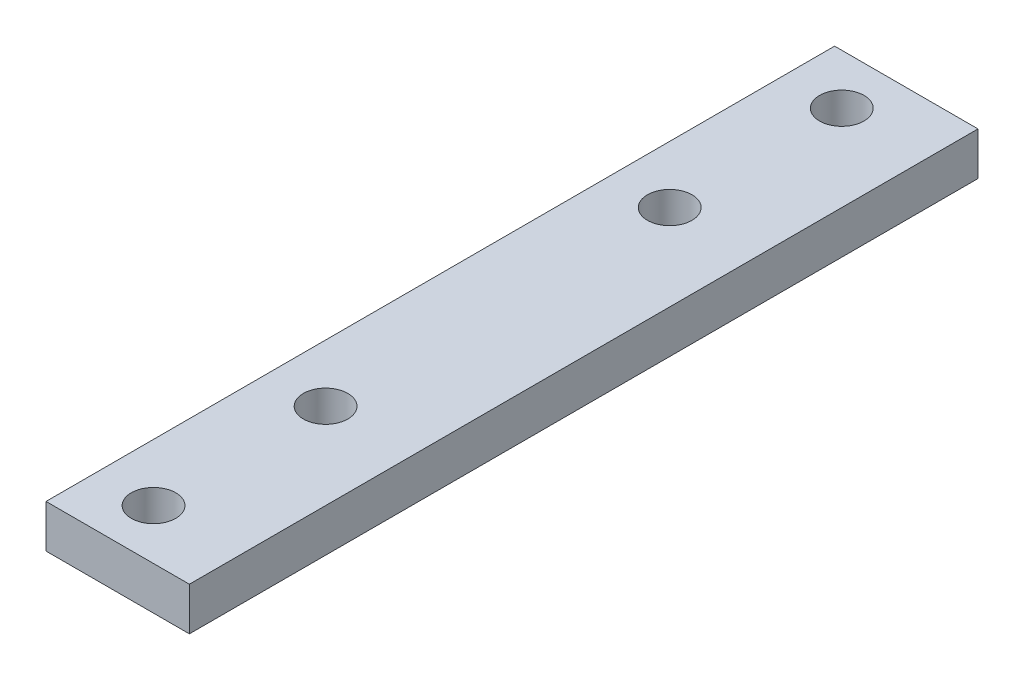
from build123d import *

# Parameters (mm, degrees)
BOSS_EXTRUDE1_DEPTH = 45
SKETCH2_W           = 31
SKETCH2_H           = 37
BOSS_EXTRUDE3_START = -45
BOSS_EXTRUDE3_DEPTH = 45
SKETCH4_R           = 5.05
CUT_EXTRUDE1_DEPTH  = 12
SKETCH5_W           = 5
SKETCH5_H           = 35
CUT_EXTRUDE2_DEPTH  = 67.895440801
BOSS_EXTRUDE5_DEPTH = 37
BOSS_EXTRUDE6_START = 5
SKETCH7_W           = 17.5
SKETCH7_H           = 7.441015215
BOSS_EXTRUDE6_DEPTH = 5
SKETCH9_W           = 15
SKETCH9_H           = 55
SKETCH9_W_2         = 10
BOSS_EXTRUDE7_DEPTH = 3
SKETCH12_R          = 1.55
CUT_EXTRUDE5_DEPTH  = 5
SKETCH13_W          = 7
SKETCH13_H          = 4
CUT_EXTRUDE6_DEPTH  = 90.162772501
CUT_EXTRUDE7_DEPTH  = 74.993242935


with BuildPart() as part:
    # Sketch1 → Boss-Extrude1 (new body)
    with BuildSketch(Plane.XY):
        with BuildLine():
            Line((35, 0), (-35, 0))
            ThreePointArc((-35, 0), (0, -35), (35, 0))
        make_face()
    extrude(amount=BOSS_EXTRUDE1_DEPTH)

    # Sketch2 → Cut-Revolve1 (revolve, cut)
    with BuildSketch(Plane(origin=(0, 0, 0), x_dir=(1, 0, 0), z_dir=(0, 1, 0))):
        with Locations((-15.5, -22.5)):
            Rectangle(SKETCH2_W, SKETCH2_H)
    revolve(axis=Axis((0, 0, 0), (0, 0, 1)), mode=Mode.SUBTRACT)

    # Sketch3 → Boss-Extrude3 (add)
    with BuildSketch(Plane.XY.offset(45).offset(BOSS_EXTRUDE3_START)):
        with BuildLine():
            Line((-17.5, -30.310889132), (-17.5, 0))
            Line((-17.5, 0), (-35, 0))
            Line((-35, 0), (-35, -35))
            Line((-35, -35), (0, -35))
            ThreePointArc((0, -35), (-9.058666579, -33.80740392), (-17.5, -30.310889132))
        make_face()
    extrude(amount=BOSS_EXTRUDE3_DEPTH)

    # Sketch4 → Cut-Extrude1 (cut)
    with BuildSketch(Plane.ZY.offset(35)):
        with Locations((10, -17.5)):
            Circle(SKETCH4_R)
        with Locations((35, -17.5)):
            Circle(SKETCH4_R)
    extrude(amount=-CUT_EXTRUDE1_DEPTH, mode=Mode.SUBTRACT)

    # Sketch5 → Cut-Extrude2 (cut, through all)
    with BuildSketch(Plane(origin=(0, 0, 0), x_dir=(-1, 0, 0), z_dir=(0, 0, -1))):
        with Locations((32.5, -17.5)):
            Rectangle(SKETCH5_W, SKETCH5_H)
    extrude(amount=-CUT_EXTRUDE2_DEPTH, mode=Mode.SUBTRACT)

    # Sketch6 → Boss-Extrude5 (add)
    with BuildSketch(Plane(origin=(0, 0, 41), x_dir=(-1, 0, 0), z_dir=(0, 0, -1))):
        with BuildLine():
            ThreePointArc((-31, 0), (-25.966324345, -16.933694222), (-12.5, -28.368115905))
            Line((-12.5, -28.368115905), (-12.5, 0))
            Line((-12.5, 0), (-31, 0))
        make_face()
        with BuildLine():
            Line((12.5, 0), (12.5, -28.368115905))
            ThreePointArc((12.5, -28.368115905), (15.064267175, -27.093686617), (17.5, -25.588083164))
            Line((17.5, -25.588083164), (17.5, 0))
            Line((17.5, 0), (12.5, 0))
        make_face()
    extrude(amount=BOSS_EXTRUDE5_DEPTH)

    # Sketch7 → Boss-Extrude6 (add)
    with BuildSketch(Plane(origin=(0, 0, 0), x_dir=(-1, 0, 0), z_dir=(0, 0, -1)).offset(BOSS_EXTRUDE6_START)):
        with BuildLine():
            Line((-12.5, 0), (-35, 0))
            ThreePointArc((-35, 0), (-34.799393274, -3.741955075), (-34.199872698, -7.441015215))
            Line((-34.199872698, -7.441015215), (-12.5, -7.441015215))
            Line((-12.5, -7.441015215), (-12.5, 0))
        make_face()
        with Locations((21.25, -3.720507608)):
            Rectangle(SKETCH7_W, SKETCH7_H)
    boss_extrude6 = extrude(amount=-BOSS_EXTRUDE6_DEPTH)

    # Mirror1: Boss-Extrude6 across plane
    add(boss_extrude6.mirror(Plane(origin=(0, 0, 22.5), x_dir=(1, 0, 0), z_dir=(0, 0, -1))))

    # Sketch9 → Boss-Extrude7 (add)
    with BuildSketch(Plane(origin=(0, 0, 0), x_dir=(1, 0, 0), z_dir=(0, 1, 0))):
        with Locations((27.5, -22.5)):
            Rectangle(SKETCH9_W, SKETCH9_H)
        with Locations((-25, -22.5)):
            Rectangle(SKETCH9_W_2, SKETCH9_H)
    extrude(amount=BOSS_EXTRUDE7_DEPTH)

    # Sketch12 → Cut-Extrude5 (cut)
    with BuildSketch(Plane(origin=(0, 3, 0), x_dir=(1, 0, 0), z_dir=(0, 1, 0))):
        with Locations((26, 1.5)):
            Circle(SKETCH12_R)
        with Locations((26, -10.5)):
            Circle(SKETCH12_R)
        with Locations((26, -34.5)):
            Circle(SKETCH12_R)
        with Locations((26, -46.5)):
            Circle(SKETCH12_R)
        with Locations((-26, 1.5)):
            Circle(SKETCH12_R)
        with Locations((-26, -10.5)):
            Circle(SKETCH12_R)
        with Locations((-26, -34.5)):
            Circle(SKETCH12_R)
        with Locations((-26, -46.5)):
            Circle(SKETCH12_R)
    extrude(amount=-CUT_EXTRUDE5_DEPTH, mode=Mode.SUBTRACT)

    # Sketch13 → Cut-Extrude6 (cut, through all)
    with BuildSketch(Plane(origin=(35, 0, 0), x_dir=(0, 0, -1), z_dir=(1, 0, 0))):
        with Locations((-46.5, -2)):
            Rectangle(SKETCH13_W, SKETCH13_H)
        with Locations((-34.5, -2)):
            Rectangle(SKETCH13_W, SKETCH13_H)
        with Locations((-10.5, -2)):
            Rectangle(SKETCH13_W, SKETCH13_H)
        with Locations((1.5, -2)):
            Rectangle(SKETCH13_W, SKETCH13_H)
    extrude(amount=-CUT_EXTRUDE6_DEPTH, mode=Mode.SUBTRACT)

    # Sketch14 → Cut-Extrude7 (cut, through all)
    with BuildSketch(Plane.XY.offset(50)):
        Polygon((-30, 0), (17.520447439, 0), (17.520447439, 7.572765699), (35.300582727, 7.572765699), (35.300582727, 0), (35.300582727, -35.487417881), (-30, -35.487417881), align=None)
    extrude(amount=-CUT_EXTRUDE7_DEPTH, mode=Mode.SUBTRACT)


solid = part.part
